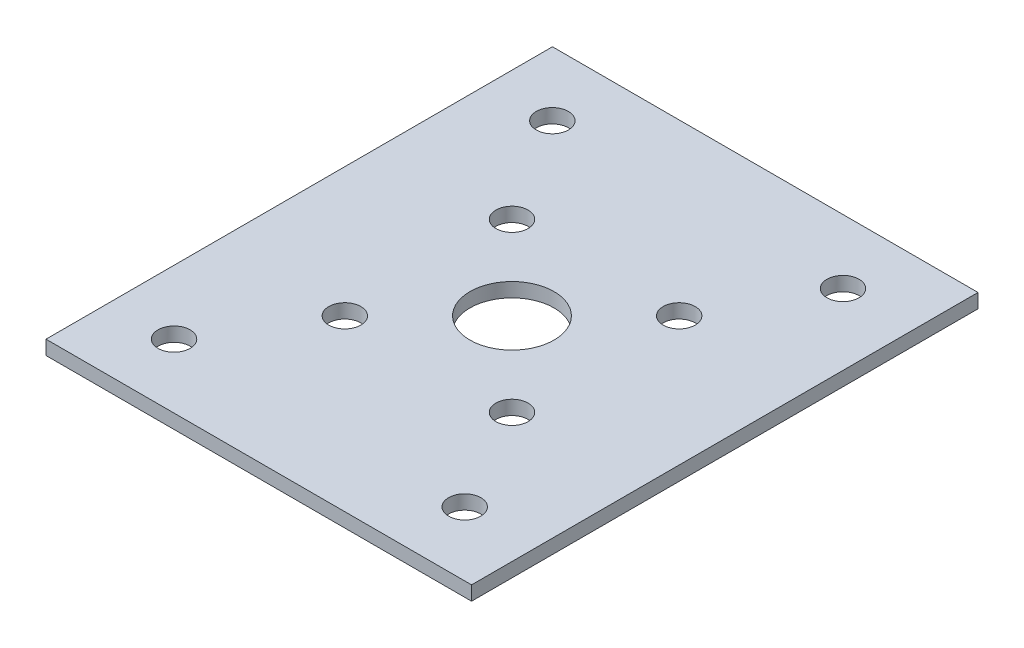
from build123d import *

# Parameters (mm, degrees)
SKETCH2_W            = 45
SKETCH2_H            = 53.556000076
BOSS_EXTRUDE1_DEPTH  = 1.5
M3_CLEARANCE_HOLE_D  = 3.4
M3_CLEARANCE_HOLE1_D = 3.4
CUT_EXTRUDE1_REACH   = 37.008
SKETCH17_R           = 4.445


with BuildPart() as part:
    # Sketch2 → Boss-Extrude1 (new body)
    with BuildSketch(Plane(origin=(0, 0, 0), x_dir=(1, 0, 0), z_dir=(0, 1, 0))):
        Rectangle(SKETCH2_W, SKETCH2_H)
    extrude(amount=BOSS_EXTRUDE1_DEPTH)

    # M3 Clearance Hole (through all)
    with Locations(Plane(origin=(0, 1.5, 0), x_dir=(1, 0, 0), z_dir=(0, 1, 0))):
        with Locations((-15.736599944, 20), (15, 20), (15, -20), (-15.736599944, -20), (0, 0)):
            Hole(M3_CLEARANCE_HOLE_D / 2)

    # M3 Clearance Hole1 (through all)
    with Locations(Plane(origin=(0, 1.5, 0), x_dir=(1, 0, 0), z_dir=(0, 1, 0))):
        with Locations((-8.838834765, -8.838834765), (-8.838834765, 8.838834765), (8.838834765, -8.838834765), (8.838834765, 8.838834765)):
            Hole(M3_CLEARANCE_HOLE1_D / 2)

    # Sketch17 → Cut-Extrude1 (cut, up to next)
    with BuildSketch(Plane(origin=(0, 1.5, 0), x_dir=(1, 0, 0), z_dir=(0, 1, 0)), mode=Mode.PRIVATE) as cut_extrude1_sk1:
        with Locations(Location((0, 0, 0), (0, 0, 270))):
            Circle(SKETCH17_R)
    cut_extrude1_tool1 = extrude(cut_extrude1_sk1.sketch, amount=-CUT_EXTRUDE1_REACH, mode=Mode.PRIVATE) & part.part
    add(cut_extrude1_tool1.solids().sort_by_distance((0, 1.5, 0))[0], mode=Mode.SUBTRACT)


solid = part.part
